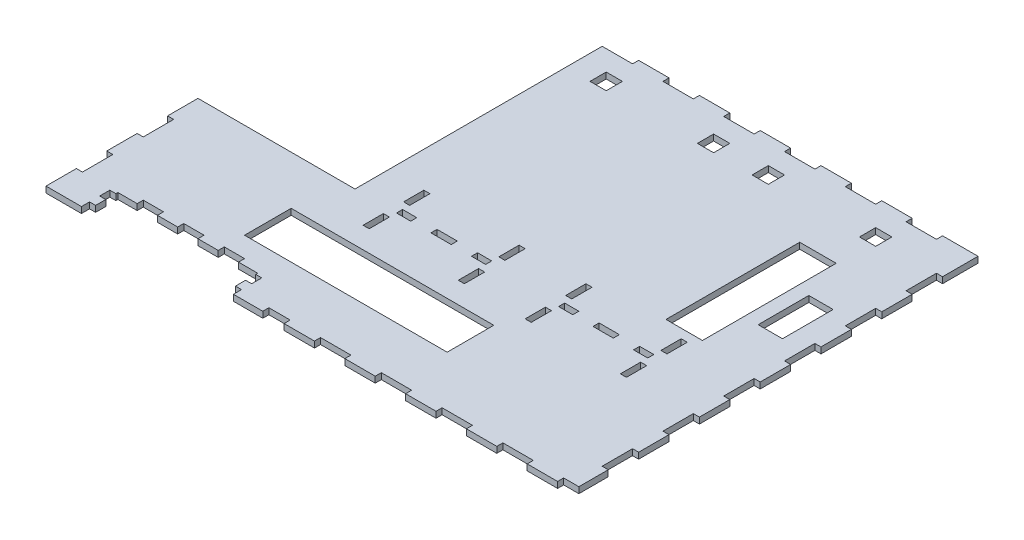
from build123d import *

# Parameters (mm, degrees)
CROQUIS1_W              = 10
CROQUIS1_H              = 3
CROQUIS1_W_2            = 3
CROQUIS1_H_2            = 10
CROQUIS1_W_3            = 7
CROQUIS1_W_4            = 8
CROQUIS1_H_3            = 8
SALIENTE_EXTRUIR1_DEPTH = 3
SKETCH1_W               = 12
SKETCH1_H               = 25
SKETCH1_W_2             = 18
SKETCH1_H_2             = 66
CUT_EXTRUDE2_DEPTH      = 10


with BuildPart() as part:
    # Croquis1 → Saliente-Extruir1 (new body)
    with BuildSketch(Plane(origin=(0, 0, 0), x_dir=(1, 0, 0), z_dir=(0, 1, 0))):
        Polygon((17.5, 79), (20.5, 79), (20.5, 80), (25.626440042, 80), (30, 80), (30, 83), (40, 83), (40, 80), (50, 80), (50, 83), (60, 83), (60, 80), (70, 80), (70, 83), (80, 83), (80, 80), (84.373559958, 80), (89.5, 80), (89.5, 79), (92.5, 79), (92.5, 74), (89.5, 74), (89.5, 69), (92.5, 69), (92.5, 65), (107, 65), (107, 68), (117.5, 68), (117.5, 65), (132.5, 65), (132.5, 68), (147.5, 68), (147.5, 65), (162.5, 65), (162.5, 68), (177.5, 68), (177.5, 65), (192.5, 65), (192.5, 68), (207.5, 68), (207.5, 65), (222.5, 65), (222.5, 68), (237.5, 68), (237.5, 65), (252.5, 65), (252.5, 68), (260, 68), (260, 82.5), (257, 82.5), (257, 97.5), (260, 97.5), (260, 112.5), (257, 112.5), (257, 127.5), (260, 127.5), (260, 142.5), (257, 142.5), (257, 157.5), (260, 157.5), (260, 172.5), (257, 172.5), (257, 187.5), (260, 187.5), (260, 202.5), (257, 202.5), (257, 217.5), (260, 217.5), (260, 232.5), (257, 232.5), (257, 247.5), (260, 247.5), (260, 265), (242.5, 265), (242.5, 262), (227.5, 262), (227.5, 265), (212.5, 265), (212.5, 262), (197.5, 262), (197.5, 265), (182.5, 265), (182.5, 262), (167.5, 262), (167.5, 265), (152.5, 265), (152.5, 262), (137.5, 262), (137.5, 265), (122.5, 265), (122.5, 262), (107.5, 262), (107.5, 265), (92.5, 265), (92.5, 262), (77.5, 262), (77.5, 155), (77.5, 140), (3, 140), (0, 140), (0, 125), (3, 125), (3, 110), (0, 110), (0, 95), (3, 95), (3, 80), (0, 80), (0, 65), (17.5, 65), (17.5, 69), (20.5, 69), (20.5, 74), (17.5, 74), align=None)
        with Locations((120, 141.5)):
            Rectangle(CROQUIS1_W, CROQUIS1_H, mode=Mode.SUBTRACT)
        Polygon((120, 93), (70, 93), (70, 116), (170, 116), (170, 93), align=None, mode=Mode.SUBTRACT)
        with Locations((200, 141.5)):
            Rectangle(CROQUIS1_W, CROQUIS1_H, mode=Mode.SUBTRACT)
        with Locations((96.5, 151.5)):
            Rectangle(CROQUIS1_W_2, CROQUIS1_H_2, mode=Mode.SUBTRACT)
        with Locations((96.5, 131.5)):
            Rectangle(CROQUIS1_W_2, CROQUIS1_H_2, mode=Mode.SUBTRACT)
        with Locations((101.5, 141.5)):
            Rectangle(CROQUIS1_W_3, CROQUIS1_H, mode=Mode.SUBTRACT)
        with Locations((143.5, 151.5)):
            Rectangle(CROQUIS1_W_2, CROQUIS1_H_2, mode=Mode.SUBTRACT)
        with Locations((143.5, 131.5)):
            Rectangle(CROQUIS1_W_2, CROQUIS1_H_2, mode=Mode.SUBTRACT)
        with Locations((176.5, 151.5)):
            Rectangle(CROQUIS1_W_2, CROQUIS1_H_2, mode=Mode.SUBTRACT)
        with Locations((138.5, 141.5)):
            Rectangle(CROQUIS1_W_3, CROQUIS1_H, mode=Mode.SUBTRACT)
        with Locations((181.5, 141.5)):
            Rectangle(CROQUIS1_W_3, CROQUIS1_H, mode=Mode.SUBTRACT)
        with Locations((223.5, 151.5)):
            Rectangle(CROQUIS1_W_2, CROQUIS1_H_2, mode=Mode.SUBTRACT)
        with Locations((218.5, 141.5)):
            Rectangle(CROQUIS1_W_3, CROQUIS1_H, mode=Mode.SUBTRACT)
        with Locations((176.5, 131.5)):
            Rectangle(CROQUIS1_W_2, CROQUIS1_H_2, mode=Mode.SUBTRACT)
        with Locations((223.5, 131.5)):
            Rectangle(CROQUIS1_W_2, CROQUIS1_H_2, mode=Mode.SUBTRACT)
        with Locations((93.5, 248)):
            Rectangle(CROQUIS1_W_4, CROQUIS1_H_3, mode=Mode.SUBTRACT)
        with Locations((146.5, 248)):
            Rectangle(CROQUIS1_W_4, CROQUIS1_H_3, mode=Mode.SUBTRACT)
        with Locations((173.5, 248)):
            Rectangle(CROQUIS1_W_4, CROQUIS1_H_3, mode=Mode.SUBTRACT)
        with Locations((226.5, 248)):
            Rectangle(CROQUIS1_W_4, CROQUIS1_H_3, mode=Mode.SUBTRACT)
    extrude(amount=SALIENTE_EXTRUIR1_DEPTH)

    # Sketch1 → Cut-Extrude2 (cut)
    with BuildSketch(Plane.XZ):
        with Locations((241, -194)):
            Rectangle(SKETCH1_W, SKETCH1_H)
        with Locations((219, -194)):
            Rectangle(SKETCH1_W_2, SKETCH1_H_2)
    extrude(amount=-CUT_EXTRUDE2_DEPTH, mode=Mode.SUBTRACT)


solid = part.part
